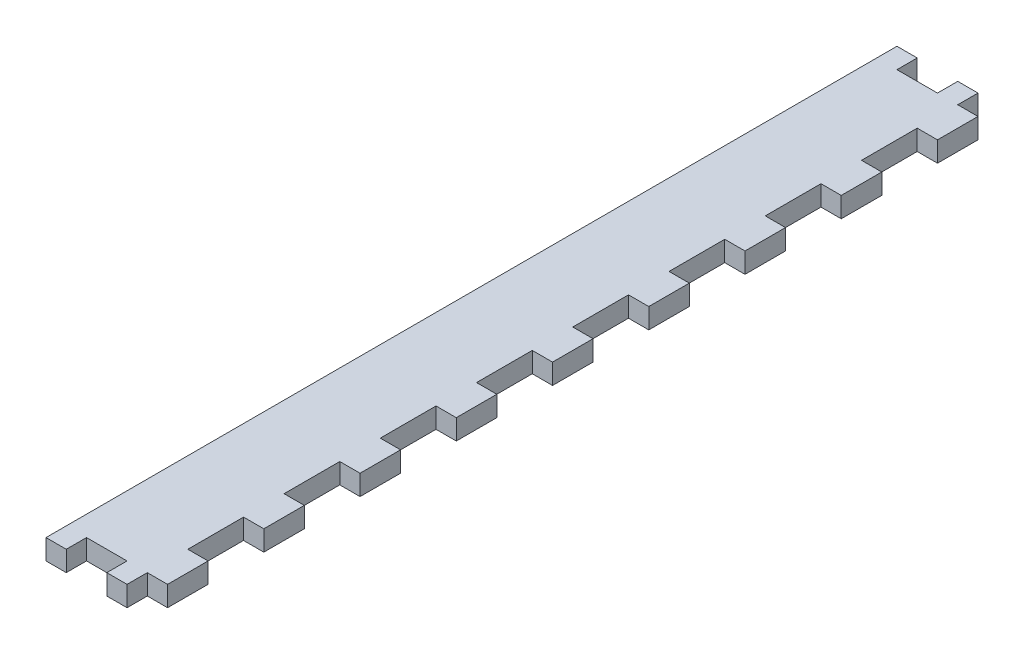
from build123d import *

# Parameters (mm, degrees)
SKETCH1_W           = 50.8
SKETCH1_H           = 533.4
BOSS_EXTRUDE1_DEPTH = 12.7
SKETCH2_W           = 12.7
SKETCH2_H           = 25.4
BOSS_EXTRUDE2_DEPTH = 12.7
SKETCH7_W           = 25.4
SKETCH7_H           = 12.7
CUT_EXTRUDE3_DEPTH  = 538.316573353


with BuildPart() as part:
    # Sketch1 → Boss-Extrude1 (new body)
    with BuildSketch(Plane(origin=(0, 0, 0), x_dir=(1, 0, 0), z_dir=(0, 1, 0))):
        with Locations((25.4, 266.7)):
            Rectangle(SKETCH1_W, SKETCH1_H)
    extrude(amount=BOSS_EXTRUDE1_DEPTH)

    # Sketch2 → Boss-Extrude2 (add, through all)
    with BuildSketch(Plane(origin=(0, 12.7, 0), x_dir=(1, 0, 0), z_dir=(0, 1, 0))):
        with Locations((57.15, 508)):
            Rectangle(SKETCH2_W, SKETCH2_H)
        with Locations((57.15, 447.675)):
            Rectangle(SKETCH2_W, SKETCH2_H)
        with Locations((57.15, 387.35)):
            Rectangle(SKETCH2_W, SKETCH2_H)
        with Locations((57.15, 327.025)):
            Rectangle(SKETCH2_W, SKETCH2_H)
        with Locations((57.15, 266.7)):
            Rectangle(SKETCH2_W, SKETCH2_H)
        with Locations((57.15, 206.375)):
            Rectangle(SKETCH2_W, SKETCH2_H)
        with Locations((57.15, 146.05)):
            Rectangle(SKETCH2_W, SKETCH2_H)
        with Locations((57.15, 85.725)):
            Rectangle(SKETCH2_W, SKETCH2_H)
        with Locations((57.15, 25.4)):
            Rectangle(SKETCH2_W, SKETCH2_H)
    extrude(amount=-BOSS_EXTRUDE2_DEPTH)

    # Sketch7 → Cut-Extrude3 (cut, through all)
    with BuildSketch(Plane(origin=(0, 12.7, 0), x_dir=(1, 0, 0), z_dir=(0, 1, 0))):
        with Locations((25.4, 6.35)):
            Rectangle(SKETCH7_W, SKETCH7_H)
        with Locations((25.4, 527.05)):
            Rectangle(SKETCH7_W, SKETCH7_H)
    extrude(amount=-CUT_EXTRUDE3_DEPTH, mode=Mode.SUBTRACT)


solid = part.part
